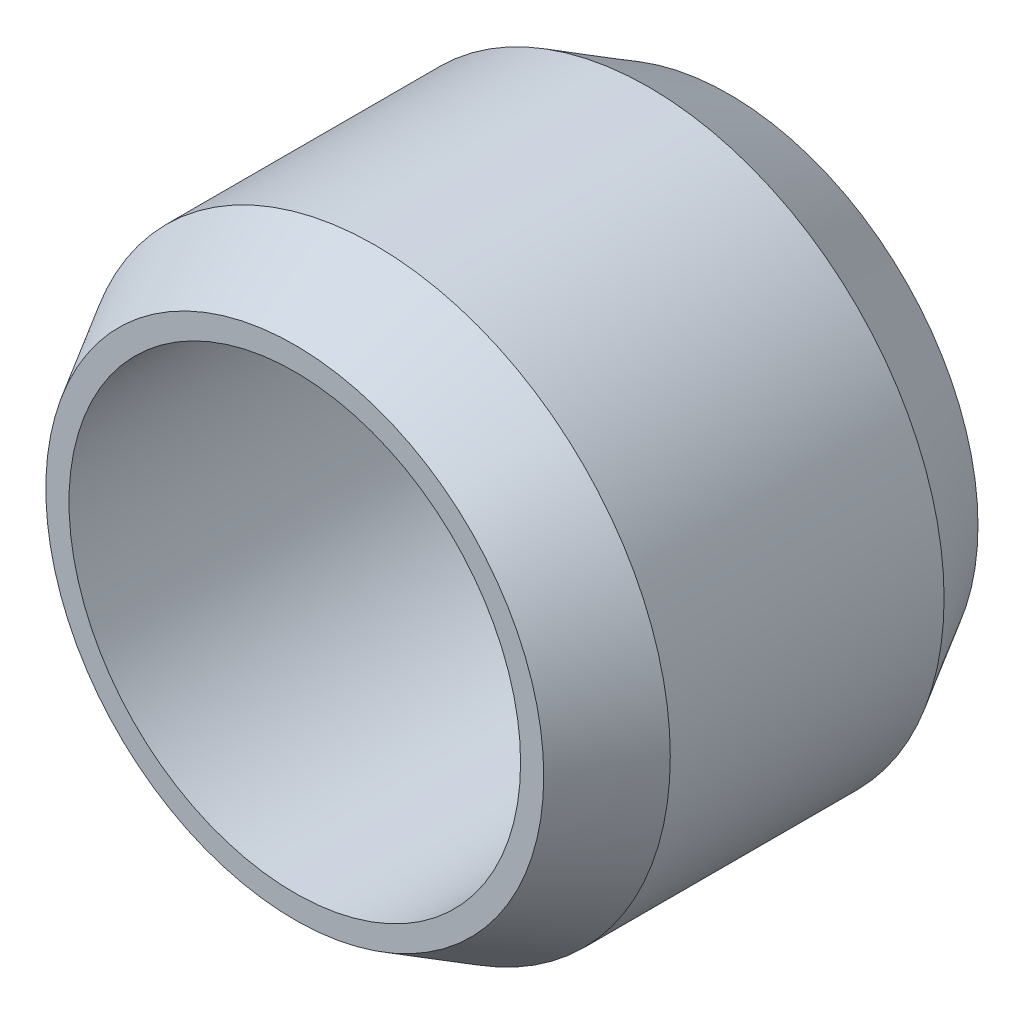
from build123d import *


with BuildPart() as part:
    # Sketch2 → Revolve1 (revolve)
    with BuildSketch(Plane(origin=(0, 0, 0), x_dir=(0, 0, -1), z_dir=(1, 0, 0)), mode=Mode.PRIVATE) as revolve1_sk:
        Polygon((-3.175, 3.302), (-3.175, 3.640666667), (-2.001824253, 4.318), (2.001824253, 4.318), (3.175, 3.640666667), (3.175, 3.302), align=None)
    revolve(revolve1_sk.sketch.rotate(Axis((0, 0, 3.175), (0, 0, -1)), 90), axis=Axis((0, 0, 3.175), (0, 0, -1)))


solid = part.part
